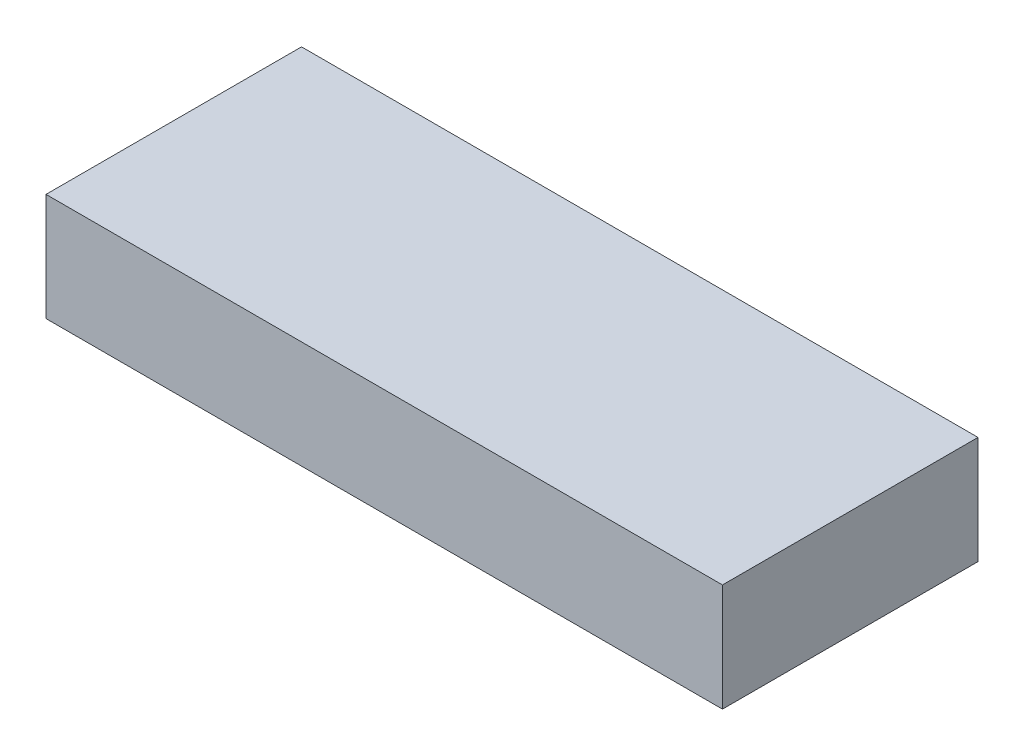
from build123d import *

# Parameters (mm, degrees)
SKETCH1_W           = 50.3
SKETCH1_H           = 19
BOSS_EXTRUDE1_DEPTH = 8


with BuildPart() as part:
    # Sketch1 → Boss-Extrude1 (new body)
    with BuildSketch(Plane(origin=(0, 0, 0), x_dir=(1, 0, 0), z_dir=(0, 1, 0))):
        with Locations((-26.594680851, -1.617021277)):
            Rectangle(SKETCH1_W, SKETCH1_H)
    extrude(amount=BOSS_EXTRUDE1_DEPTH)


solid = part.part
